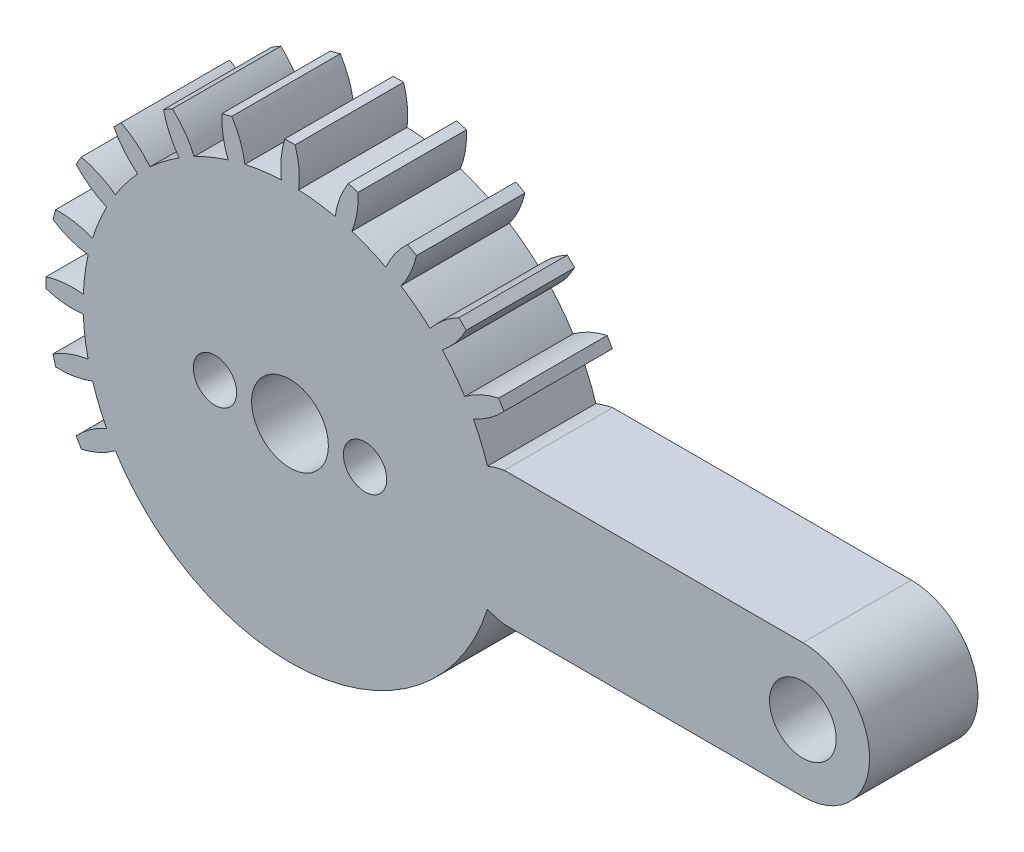
from build123d import *

# Parameters (mm, degrees)
SKETCH1_R           = 1.75
SKETCH1_R_2         = 2
BOSS_EXTRUDE1_DEPTH = 6.5
SKETCH2_R           = 2.3
SKETCH2_R_2         = 1.3
CUT_EXTRUDE1_DEPTH  = 39.260284892


with BuildPart() as part:
    # Sketch1 → Boss-Extrude1 (new body)
    with BuildSketch(Plane.XY):
        with BuildLine():
            Line((0.31, 14.63), (-0.31, 14.63))
            ThreePointArc((-0.31, 14.63), (-0.532517386, 13.523085628), (-0.52, 12.394096377))
            ThreePointArc((-0.52, 12.394096377), (-1.619177414, 12.298873505), (-2.70554676, 12.106363687))
            ThreePointArc((-2.70554676, 12.106363687), (-2.985659813, 13.2001233), (-3.487085624, 14.211728743))
            Line((-3.487085624, 14.211728743), (-4.085959636, 14.051260935))
            ThreePointArc((-4.085959636, 14.051260935), (-4.014404405, 12.924472018), (-3.710109619, 11.837191881))
            ThreePointArc((-3.710109619, 11.837191881), (-4.747187978, 11.460725601), (-5.746714978, 10.993602319))
            ThreePointArc((-5.746714978, 10.993602319), (-6.30036923, 11.977594384), (-7.046532125, 12.824951657))
            Line((-7.046532125, 12.824951657), (-7.583467875, 12.514951657))
            ThreePointArc((-7.583467875, 12.514951657), (-7.222716398, 11.445076999), (-6.647381398, 10.473602319))
            ThreePointArc((-6.647381398, 10.473602319), (-7.551685527, 9.841548186), (-8.396254069, 9.131645121))
            ThreePointArc((-8.396254069, 9.131645121), (-9.185718896, 9.938812205), (-10.125769107, 10.564175311))
            Line((-10.125769107, 10.564175311), (-10.564175311, 10.125769107))
            ThreePointArc((-10.564175311, 10.125769107), (-9.938812205, 9.185718896), (-9.131645121, 8.396254069))
            ThreePointArc((-9.131645121, 8.396254069), (-9.841548186, 7.551685527), (-10.473602319, 6.647381398))
            ThreePointArc((-10.473602319, 6.647381398), (-11.445076999, 7.222716398), (-12.514951657, 7.583467875))
            Line((-12.514951657, 7.583467875), (-12.824951657, 7.046532125))
            ThreePointArc((-12.824951657, 7.046532125), (-11.977594384, 6.30036923), (-10.993602319, 5.746714978))
            ThreePointArc((-10.993602319, 5.746714978), (-11.460725601, 4.747187978), (-11.837191881, 3.710109619))
            ThreePointArc((-11.837191881, 3.710109619), (-12.924472018, 4.014404405), (-14.051260935, 4.085959636))
            Line((-14.051260935, 4.085959636), (-14.211728743, 3.487085624))
            ThreePointArc((-14.211728743, 3.487085624), (-13.2001233, 2.985659813), (-12.106363687, 2.70554676))
            ThreePointArc((-12.106363687, 2.70554676), (-12.298873505, 1.619177414), (-12.394096377, 0.52))
            ThreePointArc((-12.394096377, 0.52), (-13.523085628, 0.532517386), (-14.63, 0.31))
            Line((-14.63, 0.31), (-14.63, -0.31))
            ThreePointArc((-14.63, -0.31), (-13.523085628, -0.532517386), (-12.394096377, -0.52))
            ThreePointArc((-12.394096377, -0.52), (-12.298873505, -1.619177414), (-12.106363687, -2.70554676))
            ThreePointArc((-12.106363687, -2.70554676), (-13.2001233, -2.985659813), (-14.211728743, -3.487085624))
            Line((-14.211728743, -3.487085624), (-14.051260935, -4.085959636))
            ThreePointArc((-14.051260935, -4.085959636), (-12.924472018, -4.014404405), (-11.837191881, -3.710109619))
            ThreePointArc((-11.837191881, -3.710109619), (-11.460725601, -4.747187978), (-10.993602319, -5.746714978))
            ThreePointArc((-10.993602319, -5.746714978), (-11.977594384, -6.30036923), (-12.824951657, -7.046532125))
            Line((-12.824951657, -7.046532125), (-12.514951657, -7.583467875))
            ThreePointArc((-12.514951657, -7.583467875), (-11.445076999, -7.222716398), (-10.473602319, -6.647381398))
            ThreePointArc((-10.473602319, -6.647381398), (1.619177414, -12.298873505), (11.837191881, -3.710109619))
            ThreePointArc((11.837191881, -3.710109619), (12.333238692, -3.879500788), (12.84337176, -4))
            Line((12.84337176, -4), (30.75, -4))
            ThreePointArc((30.75, -4), (34.75, 0), (30.75, 4))
            Line((30.75, 4), (12.84337176, 4))
            ThreePointArc((12.84337176, 4), (12.333238692, 3.879500788), (11.837191881, 3.710109619))
            ThreePointArc((11.837191881, 3.710109619), (11.460725601, 4.747187978), (10.993602319, 5.746714978))
            ThreePointArc((10.993602319, 5.746714978), (11.977594384, 6.30036923), (12.824951657, 7.046532125))
            Line((12.824951657, 7.046532125), (12.514951657, 7.583467875))
            ThreePointArc((12.514951657, 7.583467875), (11.445076999, 7.222716398), (10.473602319, 6.647381398))
            ThreePointArc((10.473602319, 6.647381398), (9.841548186, 7.551685527), (9.131645121, 8.396254069))
            ThreePointArc((9.131645121, 8.396254069), (9.938812205, 9.185718896), (10.564175311, 10.125769107))
            Line((10.564175311, 10.125769107), (10.125769107, 10.564175311))
            ThreePointArc((10.125769107, 10.564175311), (9.185718896, 9.938812205), (8.396254069, 9.131645121))
            ThreePointArc((8.396254069, 9.131645121), (7.551685527, 9.841548186), (6.647381398, 10.473602319))
            ThreePointArc((6.647381398, 10.473602319), (7.222716398, 11.445076999), (7.583467875, 12.514951657))
            Line((7.583467875, 12.514951657), (7.046532125, 12.824951657))
            ThreePointArc((7.046532125, 12.824951657), (6.30036923, 11.977594384), (5.746714978, 10.993602319))
            ThreePointArc((5.746714978, 10.993602319), (4.747187978, 11.460725601), (3.710109619, 11.837191881))
            ThreePointArc((3.710109619, 11.837191881), (4.014404405, 12.924472018), (4.085959636, 14.051260935))
            Line((4.085959636, 14.051260935), (3.487085624, 14.211728743))
            ThreePointArc((3.487085624, 14.211728743), (2.985659813, 13.2001233), (2.70554676, 12.106363687))
            ThreePointArc((2.70554676, 12.106363687), (1.619177414, 12.298873505), (0.52, 12.394096377))
            ThreePointArc((0.52, 12.394096377), (0.532517386, 13.523085628), (0.31, 14.63))
        make_face()
        with Locations(Location((0, 0, 0), (0, 0, 180))):
            Circle(SKETCH1_R, mode=Mode.SUBTRACT)
        with Locations(Location((30.75, 0, 0), (0, 0, 180))):
            Circle(SKETCH1_R_2, mode=Mode.SUBTRACT)
    extrude(amount=BOSS_EXTRUDE1_DEPTH)

    # Sketch2 → Cut-Extrude1 (cut, through all)
    with BuildSketch(Plane.XY.offset(6.5)):
        Circle(SKETCH2_R)
        with Locations((4.5, 0)):
            Circle(SKETCH2_R_2)
        with Locations((-4.5, 0)):
            Circle(SKETCH2_R_2)
    extrude(amount=-CUT_EXTRUDE1_DEPTH, mode=Mode.SUBTRACT)


solid = part.part
